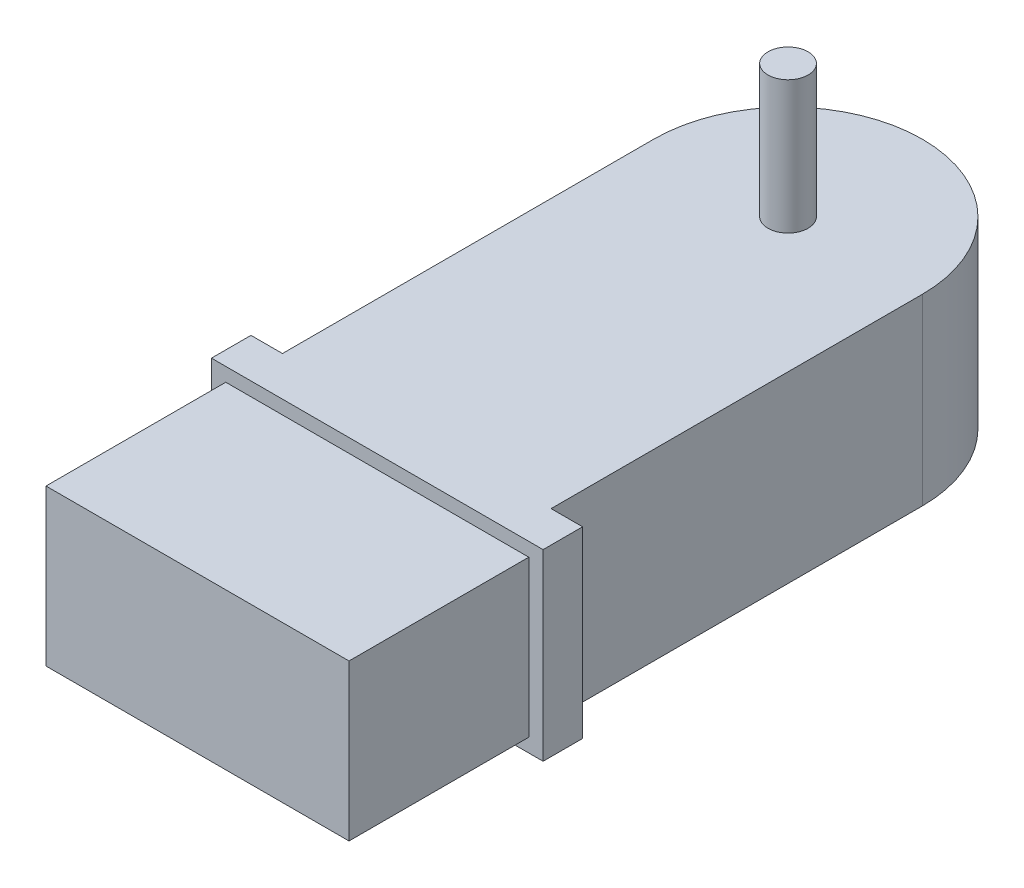
from build123d import *

# Parameters (mm, degrees)
SKETCH1_W           = 20.0406
SKETCH1_H           = 27.6987
SKETCH1_H_2         = 2.9464
SKETCH1_W_2         = 2.3495
BOSS_EXTRUDE1_DEPTH = 13.6779
SKETCH2_W           = 22.606
SKETCH2_H           = 11.6332
BOSS_EXTRUDE2_DEPTH = 13.4112
SKETCH3_R           = 1.4986
BOSS_EXTRUDE3_DEPTH = 9.906


with BuildPart() as part:
    # Sketch1 → Boss-Extrude1 (new body)
    with BuildSketch(Plane(origin=(0, 0, 0), x_dir=(1, 0, 0), z_dir=(0, 1, 0))):
        with Locations((0, 1.4732)):
            Rectangle(SKETCH1_W, SKETCH1_H)
        with Locations((0, -13.84935)):
            Rectangle(SKETCH1_W, SKETCH1_H_2)
        with Locations((-11.19505, -13.84935)):
            Rectangle(SKETCH1_W_2, SKETCH1_H_2)
        with Locations((11.19505, -13.84935)):
            Rectangle(SKETCH1_W_2, SKETCH1_H_2)
        with BuildLine():
            ThreePointArc((-10.0203, 15.32255), (0, 25.34285), (10.0203, 15.32255))
            Line((10.0203, 15.32255), (-10.0203, 15.32255))
        make_face()
    extrude(amount=BOSS_EXTRUDE1_DEPTH)

    # Sketch2 → Boss-Extrude2 (add)
    with BuildSketch(Plane.XY.offset(15.32255)):
        with Locations((0, 6.83895)):
            Rectangle(SKETCH2_W, SKETCH2_H)
    extrude(amount=BOSS_EXTRUDE2_DEPTH)

    # Sketch3 → Boss-Extrude3 (add)
    with BuildSketch(Plane(origin=(0, 13.6779, 0), x_dir=(1, 0, 0), z_dir=(0, 1, 0))):
        with Locations(Location((0, 15.32255, 0), (0, 0, 270))):
            Circle(SKETCH3_R)
    extrude(amount=BOSS_EXTRUDE3_DEPTH)


solid = part.part
